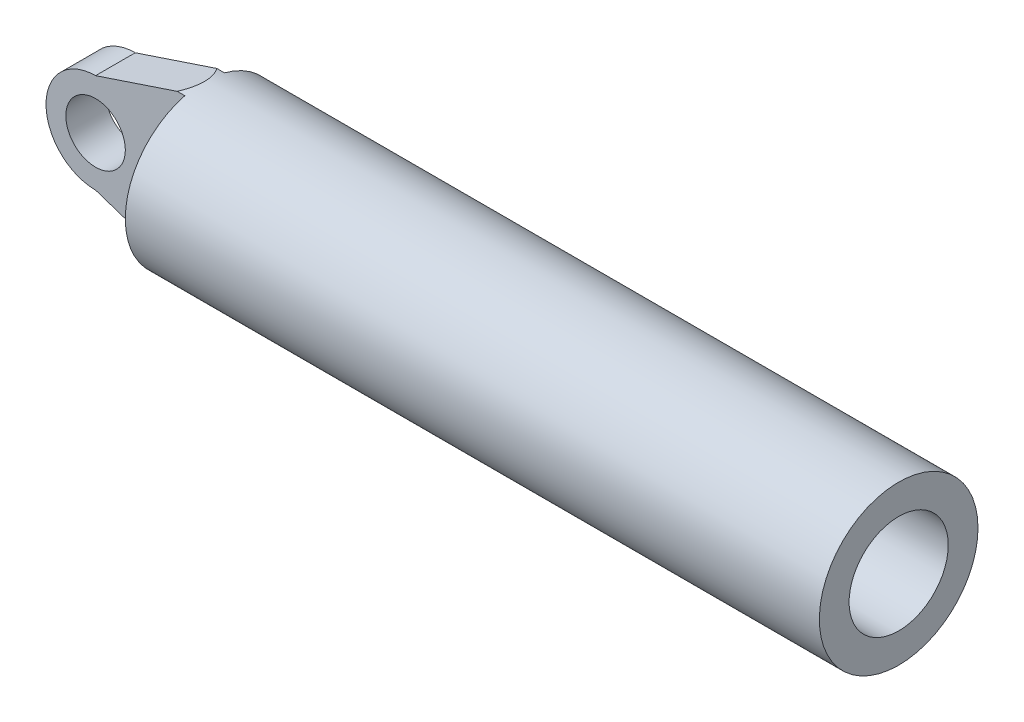
from build123d import *

# Parameters (mm, degrees)
SKETCH1_R                = 40
BOSS_EXTRUDE1_DEPTH      = 350
SHELL1_T                 = -15
BOSS_EXTRUDE2_DEPTH      = 10
BOSS_EXTRUDE2_DEPTH_BACK = 10
SKETCH3_R                = 15
CUT_EXTRUDE1_START       = -68
SKETCH4_R                = 50.16795499
SKETCH4_R_2              = 40
CUT_EXTRUDE1_DEPTH       = 68


with BuildPart() as part:
    # Sketch1 → Boss-Extrude1 (new body)
    with BuildSketch(Plane(origin=(0, 0, 0), x_dir=(0, 0, -1), z_dir=(1, 0, 0))):
        Circle(SKETCH1_R)
    extrude(amount=BOSS_EXTRUDE1_DEPTH)

    # Shell1
    shell1_openings = [part.faces().sort_by_distance(p)[0] for p in [
        (350, 0, 0),
    ]]
    offset(amount=SHELL1_T, openings=shell1_openings, kind=Kind.INTERSECTION)

    # Sketch3 → Boss-Extrude2 (add, two sides: drawn at the far end of the back side and taken through both)
    with BuildSketch(Plane.XY.offset(-BOSS_EXTRUDE2_DEPTH_BACK)):
        with BuildLine():
            Line((0, 40), (-45, 25))
            ThreePointArc((-45, 25), (-70, 0), (-45, -25))
            Line((-45, -25), (0, -40))
            Line((0, -40), (0, 40))
        make_face()
        with Locations((-45, 0)):
            Circle(SKETCH3_R, mode=Mode.SUBTRACT)
    extrude(amount=BOSS_EXTRUDE2_DEPTH + BOSS_EXTRUDE2_DEPTH_BACK)

    # Sketch4 → Cut-Extrude1 (cut)
    with BuildSketch(Plane(origin=(0, 0, 0), x_dir=(0, 0, -1), z_dir=(1, 0, 0)).offset(CUT_EXTRUDE1_START)):
        Circle(SKETCH4_R)
        Circle(SKETCH4_R_2, mode=Mode.SUBTRACT)
    extrude(amount=CUT_EXTRUDE1_DEPTH, mode=Mode.SUBTRACT)


solid = part.part
